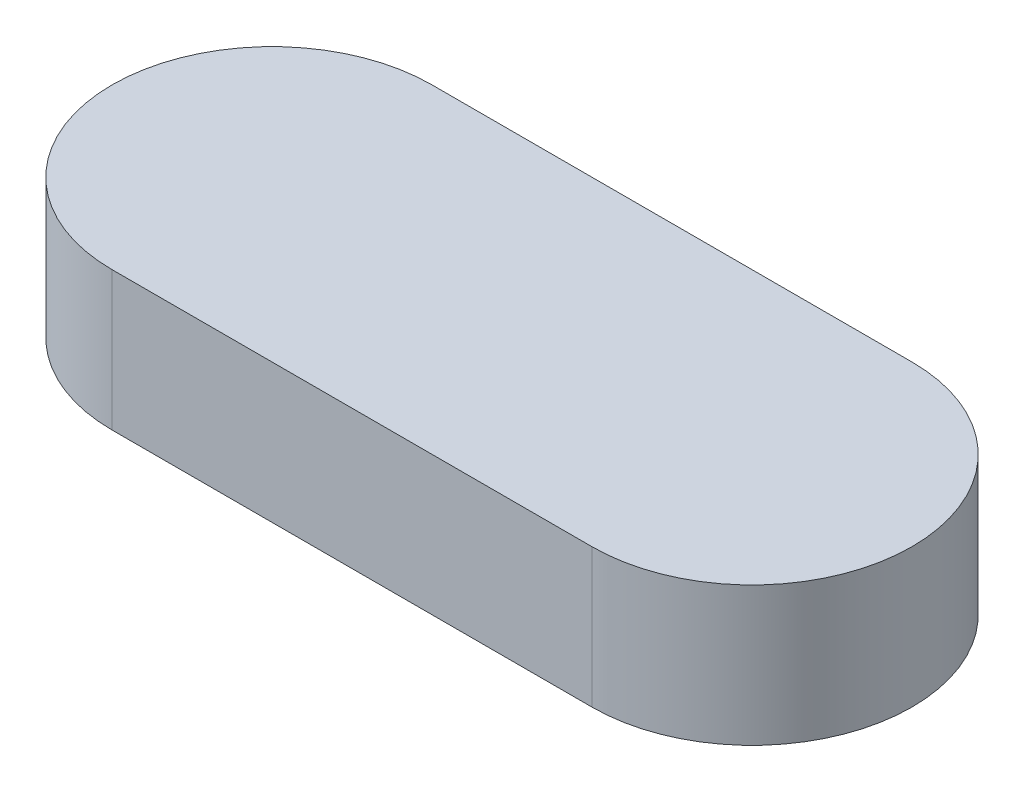
from build123d import *

# Parameters (mm, degrees)
BOSS_EXTRUDE1_DEPTH = 5.21


with BuildPart() as part:
    # Sketch1 → Boss-Extrude1 (new body)
    with BuildSketch(Plane(origin=(0, 0, 0), x_dir=(1, 0, 0), z_dir=(0, 1, 0))):
        with BuildLine():
            Line((9, -6), (-9, -6))
            ThreePointArc((-9, -6), (-15, 0), (-9, 6))
            Line((-9, 6), (9, 6))
            ThreePointArc((9, 6), (15, 0), (9, -6))
        make_face()
    extrude(amount=BOSS_EXTRUDE1_DEPTH)


solid = part.part
